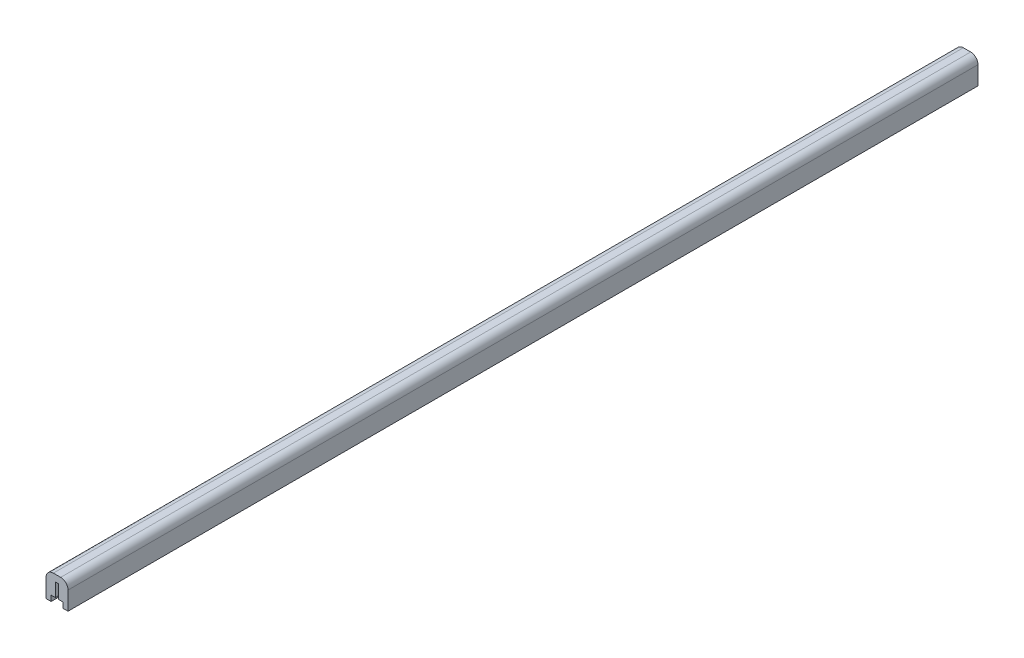
from build123d import *

# Parameters (mm, degrees)
BOSS_EXTRU_1_DEPTH = 1240


with BuildPart() as part:
    # Esquisse1 → Boss.-Extru.1 (new body)
    with BuildSketch(Plane.XY):
        with BuildLine():
            Line((-15, 0), (-15, 25))
            ThreePointArc((-15, 25), (-12.071067812, 32.071067812), (-5, 35))
            Line((-5, 35), (5, 35))
            ThreePointArc((5, 35), (12.071067812, 32.071067812), (15, 25))
            Line((15, 25), (15, 0))
            Line((15, 0), (8, 0))
            Line((8, 0), (8, 7.5))
            Line((8, 7.5), (2.25, 7.5))
            Line((2.25, 7.5), (2.25, 26))
            Line((2.25, 26), (-2.25, 26))
            Line((-2.25, 26), (-2.25, 7.5))
            Line((-2.25, 7.5), (-8, 7.5))
            Line((-8, 7.5), (-8, 0))
            Line((-8, 0), (-15, 0))
        make_face()
    extrude(amount=BOSS_EXTRU_1_DEPTH)


solid = part.part
